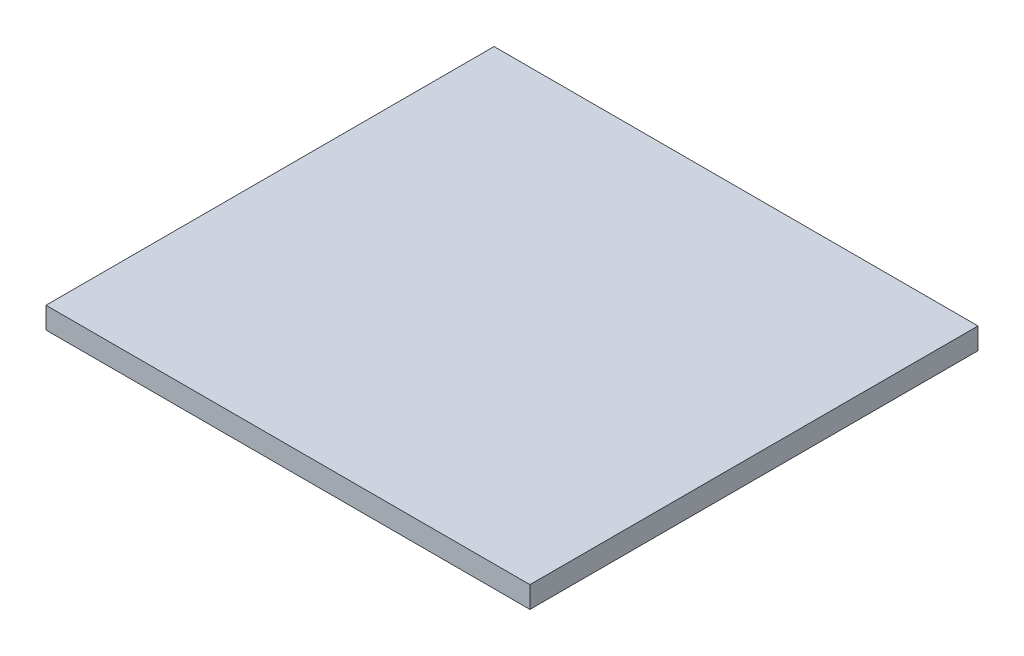
from build123d import *

# Parameters (mm, degrees)
SKDOBSONBASEMOVIL_W   = 405
SKDOBSONBASEMOVIL_H   = 375
DOBSONBASEMOVIL_DEPTH = 18


with BuildPart() as part:
    # SkDobsonBaseMovil → DobsonBaseMovil (new body)
    with BuildSketch(Plane(origin=(0, 32, 0), x_dir=(1, 0, 0), z_dir=(0, 1, 0))):
        Rectangle(SKDOBSONBASEMOVIL_W, SKDOBSONBASEMOVIL_H)
    extrude(amount=DOBSONBASEMOVIL_DEPTH)


solid = part.part
